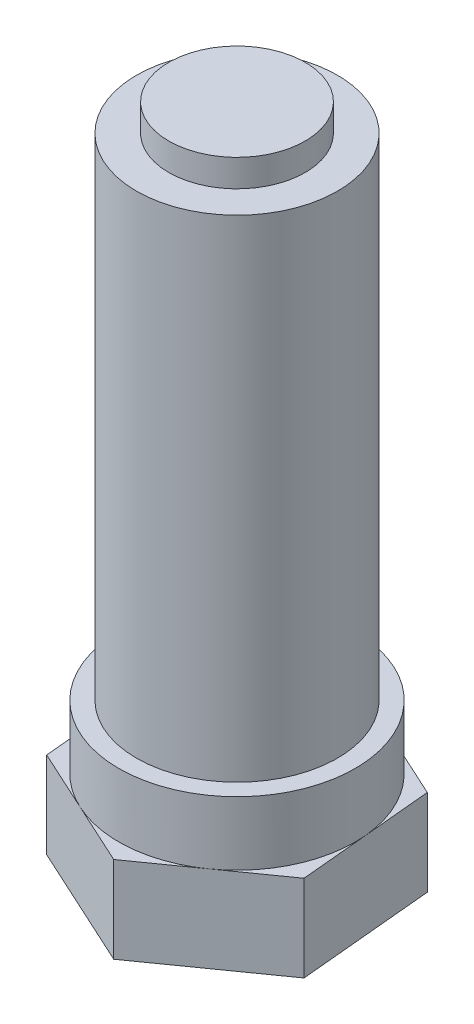
from build123d import *

# Parameters (mm, degrees)
EXTRUDE_1_DEPTH = 9.5
SKETCH_2_R      = 13
EXTRUDE_2_DEPTH = 7
SKETCH_3_R      = 11.05
EXTRUDE_3_DEPTH = 54
SKETCH_4_R      = 7.5
EXTRUDE_4_DEPTH = 3


with BuildPart() as part:
    # 草图1 → 凸台-拉伸1 (new body)
    with BuildSketch(Plane(origin=(0, 0, 0), x_dir=(1, 0, 0), z_dir=(0, 1, 0))):
        Polygon((13.639438395, -6.268895724), (12.248742148, 8.677652282), (-1.390696247, 14.946548006), (-13.639438395, 6.268895724), (-12.248742148, -8.677652282), (1.390696247, -14.946548006), align=None)
    extrude(amount=EXTRUDE_1_DEPTH)

    # 草图2 → 凸台-拉伸2 (add)
    with BuildSketch(Plane(origin=(0, 9.5, 0), x_dir=(1, 0, 0), z_dir=(0, 1, 0))):
        with Locations(Location((0, 0, 0), (0, 0, 65.31576064))):
            Circle(SKETCH_2_R)
    extrude(amount=EXTRUDE_2_DEPTH)

    # 草图3 → 凸台-拉伸3 (add)
    with BuildSketch(Plane(origin=(0, 16.5, 0), x_dir=(1, 0, 0), z_dir=(0, 1, 0))):
        with Locations(Location((0, 0, 0), (0, 0, 270))):
            Circle(SKETCH_3_R)
    extrude(amount=EXTRUDE_3_DEPTH)

    # 草图4 → 凸台-拉伸4 (add)
    with BuildSketch(Plane(origin=(0, 70.5, 0), x_dir=(1, 0, 0), z_dir=(0, 1, 0))):
        with Locations(Location((0, 0, 0), (0, 0, 270))):
            Circle(SKETCH_4_R)
    extrude(amount=EXTRUDE_4_DEPTH)


solid = part.part
